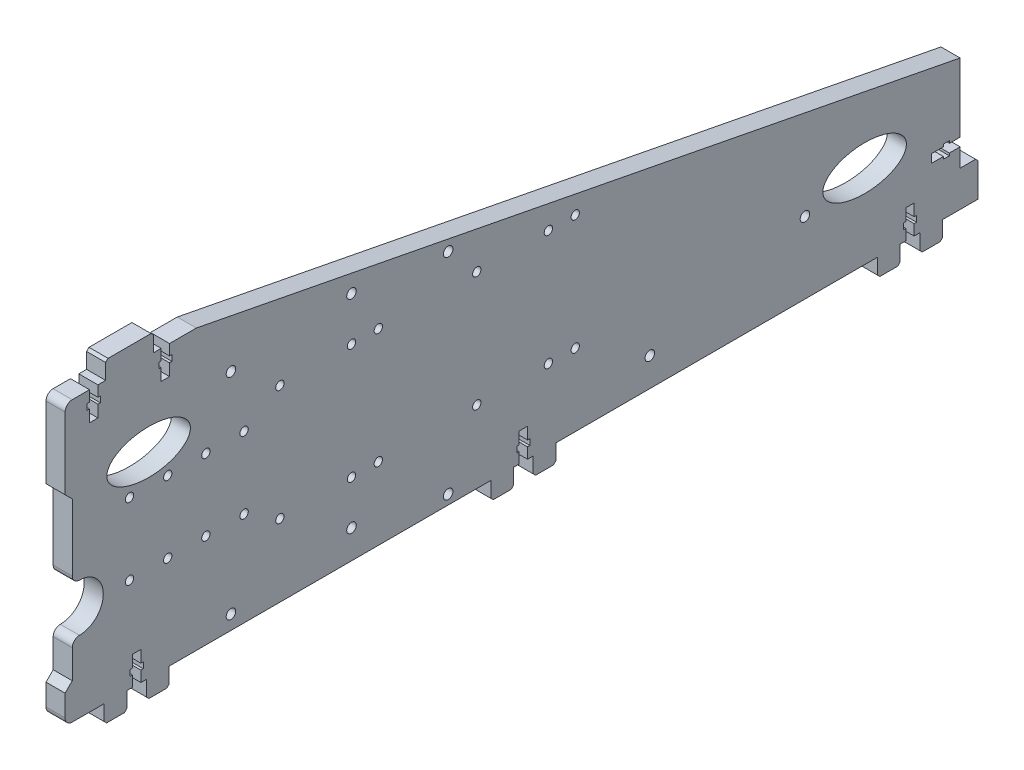
from build123d import *

# Parameters (mm, degrees)
SKETCH1_R          = 2
SKETCH1_RX         = 17.5
SKETCH1_RY         = 9.25
EXTRUDE1_DEPTH     = 8
SKETCH2_R          = 1
EXTRUDE2_DEPTH     = 1
SKETCH3_R          = 1
EXTRUDE3_DEPTH     = 1
SKETCH4_R          = 1
EXTRUDE4_DEPTH     = 1
SKETCH5_R          = 1
EXTRUDE5_DEPTH     = 1
SKETCH6_R          = 1
EXTRUDE6_DEPTH     = 1
CHAMFER1_SIZE      = 1
SKETCH7_R          = 1.75
CUT_EXTRUDE1_DEPTH = 408.249860484


with BuildPart() as part:
    # Sketch1 → Extrude1 (new body)
    with BuildSketch(Plane(origin=(0, 0, 0), x_dir=(0, 0, -1), z_dir=(1, 0, 0))):
        with BuildLine():
            Line((377.011143547, 9.438901563), (384.511143547, 9.438901563))
            Line((384.511143547, 9.438901563), (384.511143547, 24.438901563))
            Line((384.511143547, 24.438901563), (377.011143547, 24.438901563))
            Line((377.011143547, 24.438901563), (377.011143547, 32.188901563))
            Line((377.011143547, 32.188901563), (372.511143547, 32.188901563))
            Line((372.511143547, 32.188901563), (372.511143547, 31.188901563))
            Line((372.511143547, 31.188901563), (370.011143547, 31.188901563))
            Line((370.011143547, 31.188901563), (370.011143547, 32.188901563))
            Line((370.011143547, 32.188901563), (365.011143547, 32.188901563))
            Line((365.011143547, 32.188901563), (365.011143547, 35.688901563))
            Line((365.011143547, 35.688901563), (370.011143547, 35.688901563))
            Line((370.011143547, 35.688901563), (370.011143547, 36.688901563))
            Line((370.011143547, 36.688901563), (372.511143547, 36.688901563))
            Line((372.511143547, 36.688901563), (372.511143547, 35.688901563))
            Line((372.511143547, 35.688901563), (377.011143547, 35.688901563))
            Line((377.011143547, 35.688901563), (377.011143547, 64.438901563))
            Line((377.011143547, 64.438901563), (57.011143547, 126.438901563))
            Line((57.011143547, 126.438901563), (45.761143547, 126.438901563))
            Line((45.761143547, 126.438901563), (45.761143547, 121.938901563))
            Line((45.761143547, 121.938901563), (46.761143547, 121.938901563))
            Line((46.761143547, 121.938901563), (46.761143547, 119.438901563))
            Line((46.761143547, 119.438901563), (45.761143547, 119.438901563))
            Line((45.761143547, 119.438901563), (45.761143547, 114.438901563))
            Line((45.761143547, 114.438901563), (42.261143547, 114.438901563))
            Line((42.261143547, 114.438901563), (42.261143547, 119.438901563))
            Line((42.261143547, 119.438901563), (41.261143547, 119.438901563))
            Line((41.261143547, 119.438901563), (41.261143547, 121.938901563))
            Line((41.261143547, 121.938901563), (42.261143547, 121.938901563))
            Line((42.261143547, 121.938901563), (42.261143547, 126.438901563))
            Line((42.261143547, 126.438901563), (39.011143547, 126.438901563))
            Line((39.011143547, 126.438901563), (39.011143547, 132.938901563))
            Line((39.011143547, 132.938901563), (38.011143547, 133.938901563))
            Line((38.011143547, 133.938901563), (20.011143547, 133.938901563))
            Line((20.011143547, 133.938901563), (19.011143547, 132.938901563))
            Line((19.011143547, 132.938901563), (19.011143547, 126.438901563))
            Line((19.011143547, 126.438901563), (15.761143547, 126.438901563))
            Line((15.761143547, 126.438901563), (15.761143547, 121.938901563))
            Line((15.761143547, 121.938901563), (16.761143547, 121.938901563))
            Line((16.761143547, 121.938901563), (16.761143547, 119.438901563))
            Line((16.761143547, 119.438901563), (15.761143547, 119.438901563))
            Line((15.761143547, 119.438901563), (15.761143547, 114.438901563))
            Line((15.761143547, 114.438901563), (12.261143547, 114.438901563))
            Line((12.261143547, 114.438901563), (12.261143547, 119.438901563))
            Line((12.261143547, 119.438901563), (11.261143547, 119.438901563))
            Line((11.261143547, 119.438901563), (11.261143547, 121.938901563))
            Line((11.261143547, 121.938901563), (12.261143547, 121.938901563))
            Line((12.261143547, 121.938901563), (12.261143547, 126.438901563))
            Line((12.261143547, 126.438901563), (5.011143547, 126.438901563))
            ThreePointArc((5.011143547, 126.438901563), (2.889823204, 125.560221906), (2.011143547, 123.438901563))
            Line((2.011143547, 123.438901563), (2.011143547, 93.438901563))
            Line((2.011143547, 93.438901563), (5.011143547, 90.438901563))
            Line((5.011143547, 90.438901563), (5.011143547, 62.438901563))
            ThreePointArc((5.011143547, 62.438901563), (5.889823204, 60.317581219), (8.011143547, 59.438901563))
            ThreePointArc((8.011143547, 59.438901563), (18.011143547, 49.438901563), (8.011143547, 39.438901563))
            ThreePointArc((8.011143547, 39.438901563), (5.889823204, 38.560221906), (5.011143547, 36.438901563))
            Line((5.011143547, 36.438901563), (5.011143547, 24.438901563))
            Line((5.011143547, 24.438901563), (2.011143547, 21.438901563))
            Line((2.011143547, 21.438901563), (2.011143547, 12.438901563))
            ThreePointArc((2.011143547, 12.438901563), (2.889823204, 10.317581219), (5.011143547, 9.438901563))
            Line((5.011143547, 9.438901563), (18.386143547, 9.438901563))
            Line((18.386143547, 9.438901563), (18.386143547, 2.938901563))
            Line((18.386143547, 2.938901563), (19.386143547, 1.938901563))
            Line((19.386143547, 1.938901563), (26.886143547, 1.938901563))
            Line((26.886143547, 1.938901563), (27.886143547, 2.938901563))
            Line((27.886143547, 2.938901563), (27.886143547, 9.438901563))
            Line((27.886143547, 9.438901563), (30.261143547, 9.438901563))
            Line((30.261143547, 9.438901563), (30.261143547, 13.938901563))
            Line((30.261143547, 13.938901563), (29.261143547, 13.938901563))
            Line((29.261143547, 13.938901563), (29.261143547, 16.438901563))
            Line((29.261143547, 16.438901563), (30.261143547, 16.438901563))
            Line((30.261143547, 16.438901563), (30.261143547, 21.438901563))
            Line((30.261143547, 21.438901563), (33.761143547, 21.438901563))
            Line((33.761143547, 21.438901563), (33.761143547, 16.438901563))
            Line((33.761143547, 16.438901563), (34.761143547, 16.438901563))
            Line((34.761143547, 16.438901563), (34.761143547, 13.938901563))
            Line((34.761143547, 13.938901563), (33.761143547, 13.938901563))
            Line((33.761143547, 13.938901563), (33.761143547, 9.438901563))
            Line((33.761143547, 9.438901563), (36.136143547, 9.438901563))
            Line((36.136143547, 9.438901563), (36.136143547, 2.938901563))
            Line((36.136143547, 2.938901563), (37.136143547, 1.938901563))
            Line((37.136143547, 1.938901563), (44.636143547, 1.938901563))
            Line((44.636143547, 1.938901563), (45.636143547, 2.938901563))
            Line((45.636143547, 2.938901563), (45.636143547, 9.438901563))
            Line((45.636143547, 9.438901563), (180.386143547, 9.438901563))
            Line((180.386143547, 9.438901563), (180.386143547, 2.938901563))
            Line((180.386143547, 2.938901563), (181.386143547, 1.938901563))
            Line((181.386143547, 1.938901563), (188.886143547, 1.938901563))
            Line((188.886143547, 1.938901563), (189.886143547, 2.938901563))
            Line((189.886143547, 2.938901563), (189.886143547, 9.438901563))
            Line((189.886143547, 9.438901563), (192.261143547, 9.438901563))
            Line((192.261143547, 9.438901563), (192.261143547, 13.938901563))
            Line((192.261143547, 13.938901563), (191.261143547, 13.938901563))
            Line((191.261143547, 13.938901563), (191.261143547, 16.438901563))
            Line((191.261143547, 16.438901563), (192.261143547, 16.438901563))
            Line((192.261143547, 16.438901563), (192.261143547, 21.438901563))
            Line((192.261143547, 21.438901563), (195.761143547, 21.438901563))
            Line((195.761143547, 21.438901563), (195.761143547, 16.438901563))
            Line((195.761143547, 16.438901563), (196.761143547, 16.438901563))
            Line((196.761143547, 16.438901563), (196.761143547, 13.938901563))
            Line((196.761143547, 13.938901563), (195.761143547, 13.938901563))
            Line((195.761143547, 13.938901563), (195.761143547, 9.438901563))
            Line((195.761143547, 9.438901563), (198.136143547, 9.438901563))
            Line((198.136143547, 9.438901563), (198.136143547, 2.938901563))
            Line((198.136143547, 2.938901563), (199.136143547, 1.938901563))
            Line((199.136143547, 1.938901563), (206.636143547, 1.938901563))
            Line((206.636143547, 1.938901563), (207.636143547, 2.938901563))
            Line((207.636143547, 2.938901563), (207.636143547, 9.438901563))
            Line((207.636143547, 9.438901563), (342.386143547, 9.438901563))
            Line((342.386143547, 9.438901563), (342.386143547, 2.938901563))
            Line((342.386143547, 2.938901563), (343.386143547, 1.938901563))
            Line((343.386143547, 1.938901563), (350.886143547, 1.938901563))
            Line((350.886143547, 1.938901563), (351.886143547, 2.938901563))
            Line((351.886143547, 2.938901563), (351.886143547, 9.438901563))
            Line((351.886143547, 9.438901563), (354.261143547, 9.438901563))
            Line((354.261143547, 9.438901563), (354.261143547, 13.938901563))
            Line((354.261143547, 13.938901563), (353.261143547, 13.938901563))
            Line((353.261143547, 13.938901563), (353.261143547, 16.438901563))
            Line((353.261143547, 16.438901563), (354.261143547, 16.438901563))
            Line((354.261143547, 16.438901563), (354.261143547, 21.438901563))
            Line((354.261143547, 21.438901563), (357.761143547, 21.438901563))
            Line((357.761143547, 21.438901563), (357.761143547, 16.438901563))
            Line((357.761143547, 16.438901563), (358.761143547, 16.438901563))
            Line((358.761143547, 16.438901563), (358.761143547, 13.938901563))
            Line((358.761143547, 13.938901563), (357.761143547, 13.938901563))
            Line((357.761143547, 13.938901563), (357.761143547, 9.438901563))
            Line((357.761143547, 9.438901563), (360.136143547, 9.438901563))
            Line((360.136143547, 9.438901563), (360.136143547, 2.938901563))
            Line((360.136143547, 2.938901563), (361.136143547, 1.938901563))
            Line((361.136143547, 1.938901563), (368.636143547, 1.938901563))
            Line((368.636143547, 1.938901563), (369.636143547, 2.938901563))
            Line((369.636143547, 2.938901563), (369.636143547, 9.438901563))
            Line((369.636143547, 9.438901563), (377.011143547, 9.438901563))
        make_face()
        with Locations((71.511143547, 15.438901563)):
            Circle(SKETCH1_R, mode=Mode.SUBTRACT)
        with Locations((162.511143547, 13.438901563)):
            Circle(SKETCH1_R, mode=Mode.SUBTRACT)
        with Locations((71.511143547, 103.438901563)):
            Circle(SKETCH1_R, mode=Mode.SUBTRACT)
        with Locations((162.511143547, 101.438901563)):
            Circle(SKETCH1_R, mode=Mode.SUBTRACT)
        with Locations((122.011143547, 21.438901563)):
            Circle(SKETCH1_R, mode=Mode.SUBTRACT)
        with Locations((122.011143547, 106.438901563)):
            Circle(SKETCH1_R, mode=Mode.SUBTRACT)
        with Locations((247.011143547, 21.438901563)):
            Circle(SKETCH1_R, mode=Mode.SUBTRACT)
        with Locations((312.011143547, 39.438901563)):
            Circle(SKETCH1_R, mode=Mode.SUBTRACT)
        with Locations(Location((337.011143547, 44.438901563), (0, 0, 0))):
            Ellipse(SKETCH1_RX, SKETCH1_RY, mode=Mode.SUBTRACT)
        with Locations((37.011143547, 91.438901563)):
            Ellipse(SKETCH1_RX, SKETCH1_RY, mode=Mode.SUBTRACT)
    extrude(amount=EXTRUDE1_DEPTH)

    # Sketch2 → Extrude2 (cut)
    with BuildSketch(Plane(origin=(0, 114.438901563, 0), x_dir=(1, 0, 0), z_dir=(0, 1, 0))):
        with Locations(Location((4, 44.011143547, 0), (0, 0, 270))):
            Circle(SKETCH2_R)
    extrude(amount=-EXTRUDE2_DEPTH, mode=Mode.SUBTRACT)

    # Sketch3 → Extrude3 (cut)
    with BuildSketch(Plane(origin=(0, 114.438901563, 0), x_dir=(1, 0, 0), z_dir=(0, 1, 0))):
        with Locations(Location((4, 14.011143547, 0), (0, 0, 270))):
            Circle(SKETCH3_R)
    extrude(amount=-EXTRUDE3_DEPTH, mode=Mode.SUBTRACT)

    # Sketch4 → Extrude4 (cut)
    with BuildSketch(Plane.XZ.offset(-21.438901563)):
        with Locations(Location((4, -32.011143547, 0), (0, 0, 270))):
            Circle(SKETCH4_R)
    extrude(amount=-EXTRUDE4_DEPTH, mode=Mode.SUBTRACT)

    # Sketch5 → Extrude5 (cut)
    with BuildSketch(Plane.XZ.offset(-21.438901563)):
        with Locations(Location((4, -356.011143547, 0), (0, 0, 270))):
            Circle(SKETCH5_R)
    extrude(amount=-EXTRUDE5_DEPTH, mode=Mode.SUBTRACT)

    # Sketch6 → Extrude6 (cut)
    with BuildSketch(Plane(origin=(0, 0, -365.011143547), x_dir=(-1, 0, 0), z_dir=(0, 0, -1))):
        with Locations((-4, 33.938901563)):
            Circle(SKETCH6_R)
    extrude(amount=-EXTRUDE6_DEPTH, mode=Mode.SUBTRACT)

    # Chamfer1
    chamfer1_edges = [part.edges().sort_by_distance(p)[0] for p in [
        (4, 24.438901563, -384.511143547),
    ]]
    chamfer(chamfer1_edges, length=CHAMFER1_SIZE)

    # Sketch7 → Cut-Extrude1 (cut, through all)
    with BuildSketch(Plane.ZY):
        with Locations((-92.011143547, 88.088901563)):
            Circle(SKETCH7_R)
        with Locations((-92.011143547, 39.788901563)):
            Circle(SKETCH7_R)
        with Locations((-174.511143547, 39.788901563)):
            Circle(SKETCH7_R)
        with Locations((-174.511143547, 88.088901563)):
            Circle(SKETCH7_R)
        with Locations((-77.011143547, 48.938901563)):
            Circle(SKETCH7_R)
        with Locations((-61.011143547, 48.938901563)):
            Circle(SKETCH7_R)
        with Locations((-61.011143547, 78.938901563)):
            Circle(SKETCH7_R)
        with Locations((-77.011143547, 78.938901563)):
            Circle(SKETCH7_R)
        with Locations((-45.011143547, 48.938901563)):
            Circle(SKETCH7_R)
        with Locations((-45.011143547, 78.938901563)):
            Circle(SKETCH7_R)
        with Locations((-29.011143547, 48.938901563)):
            Circle(SKETCH7_R)
        with Locations((-29.011143547, 78.938901563)):
            Circle(SKETCH7_R)
        with Locations((-122.011143547, 88.088901563)):
            Circle(SKETCH7_R)
        with Locations((-122.011143547, 39.788901563)):
            Circle(SKETCH7_R)
        with Locations((-204.511143547, 88.088901563)):
            Circle(SKETCH7_R)
        with Locations((-204.511143547, 39.788901563)):
            Circle(SKETCH7_R)
        with Locations((-133.261143547, 88.088901563)):
            Circle(SKETCH7_R)
        with Locations((-133.261143547, 39.788901563)):
            Circle(SKETCH7_R)
        with Locations((-215.761143547, 88.088901563)):
            Circle(SKETCH7_R)
        with Locations((-215.761143547, 39.788901563)):
            Circle(SKETCH7_R)
    extrude(amount=-CUT_EXTRUDE1_DEPTH, mode=Mode.SUBTRACT)


solid = part.part
